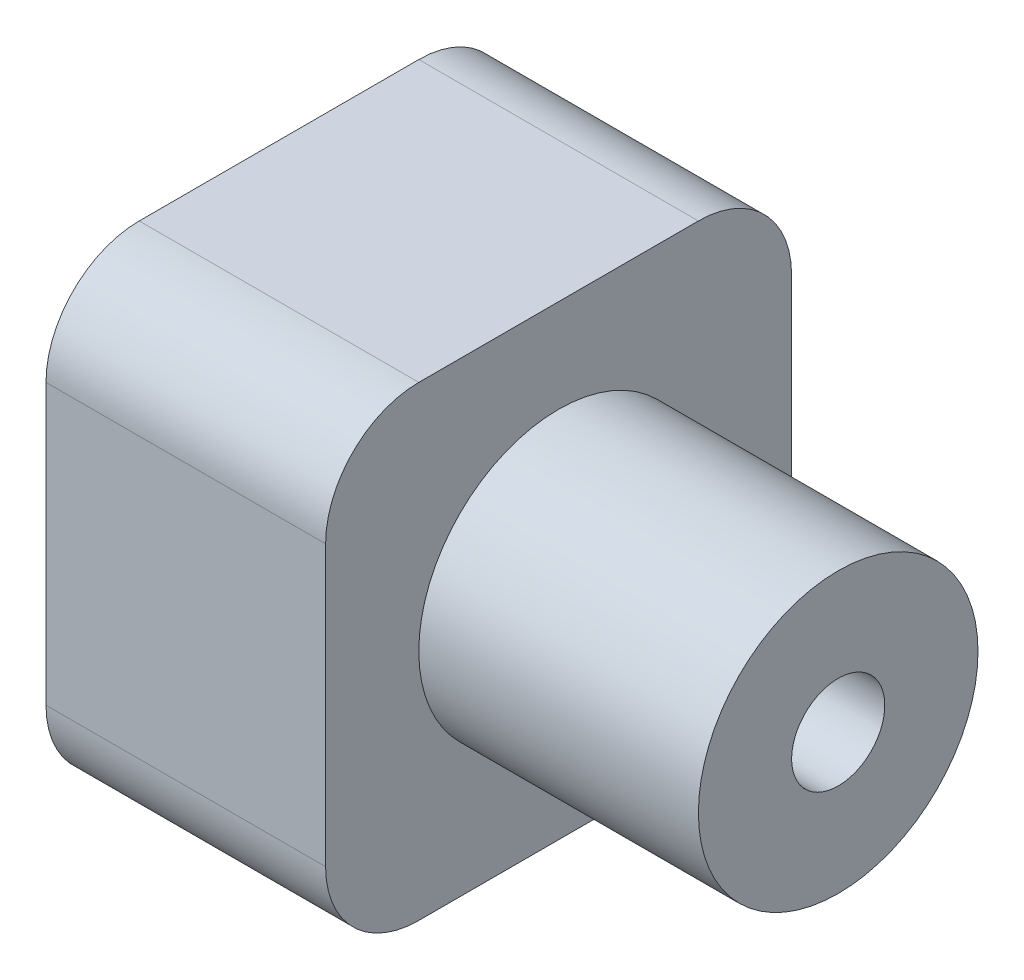
from build123d import *

# Parameters (mm, degrees)
SKETCH1_W           = 31.75
SKETCH1_H           = 31.75
BOSS_EXTRUDE1_DEPTH = 19.05
SKETCH2_R           = 9.525
SKETCH2_R_2         = 3.175
BOSS_EXTRUDE2_DEPTH = 19.05
FILLET1_R           = 6.35


with BuildPart() as part:
    # Sketch1 → Boss-Extrude1 (new body)
    with BuildSketch(Plane(origin=(0, 0, 0), x_dir=(0, 0, -1), z_dir=(1, 0, 0))):
        Rectangle(SKETCH1_W, SKETCH1_H)
    extrude(amount=BOSS_EXTRUDE1_DEPTH)

    # Sketch2 → Boss-Extrude2 (add)
    with BuildSketch(Plane(origin=(19.05, 0, 0), x_dir=(0, 0, -1), z_dir=(1, 0, 0))):
        with Locations(Location((0, 0, 0), (0, 0, 180))):
            Circle(SKETCH2_R)
        with Locations(Location((0, 0, 0), (0, 0, 180))):
            Circle(SKETCH2_R_2, mode=Mode.SUBTRACT)
    extrude(amount=BOSS_EXTRUDE2_DEPTH)

    # Fillet1
    fillet1_edges = [part.edges().sort_by_distance(p)[0] for p in [
        (9.525, -15.875, -15.875),
        (9.525, -15.875, 15.875),
        (9.525, 15.875, 15.875),
        (9.525, 15.875, -15.875),
    ]]
    fillet(fillet1_edges, radius=FILLET1_R)


solid = part.part
